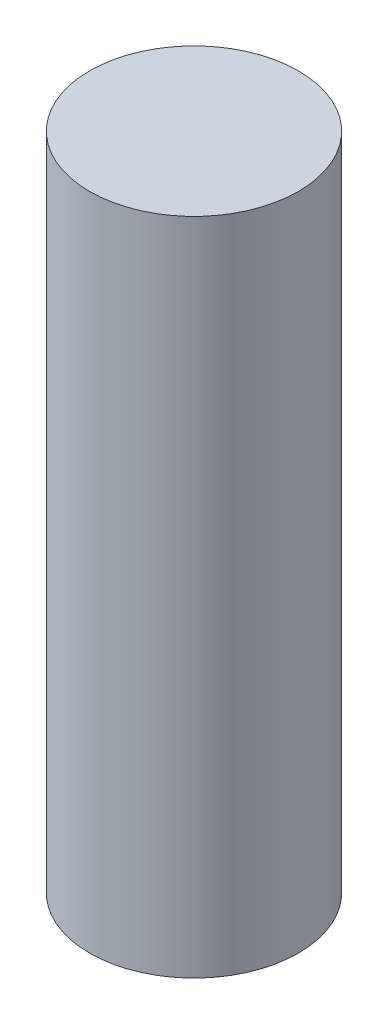
from build123d import *

# Parameters (mm, degrees)
SKETCH1_R           = 1.425
BOSS_EXTRUDE1_DEPTH = 9


with BuildPart() as part:
    # Sketch1 → Boss-Extrude1 (new body)
    with BuildSketch(Plane(origin=(0, 0, 0), x_dir=(1, 0, 0), z_dir=(0, 1, 0))):
        with Locations(Location((0, 0, 0), (0, 0, 270))):
            Circle(SKETCH1_R)
    extrude(amount=BOSS_EXTRUDE1_DEPTH)


solid = part.part
